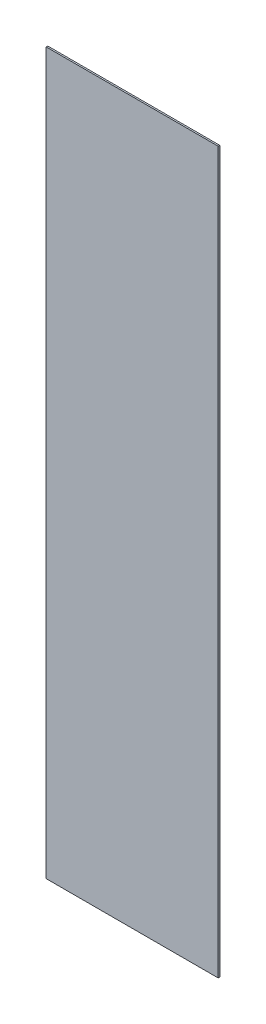
from build123d import *

# Parameters (mm, degrees)
SKETCH_1_W      = 300.8
SKETCH_1_H      = 1259.5
EXTRUDE_1_DEPTH = 2.75


with BuildPart() as part:
    # 草圖1 → 填料-伸長1 (new body)
    with BuildSketch(Plane.XY):
        Rectangle(SKETCH_1_W, SKETCH_1_H)
    extrude(amount=EXTRUDE_1_DEPTH)


solid = part.part
